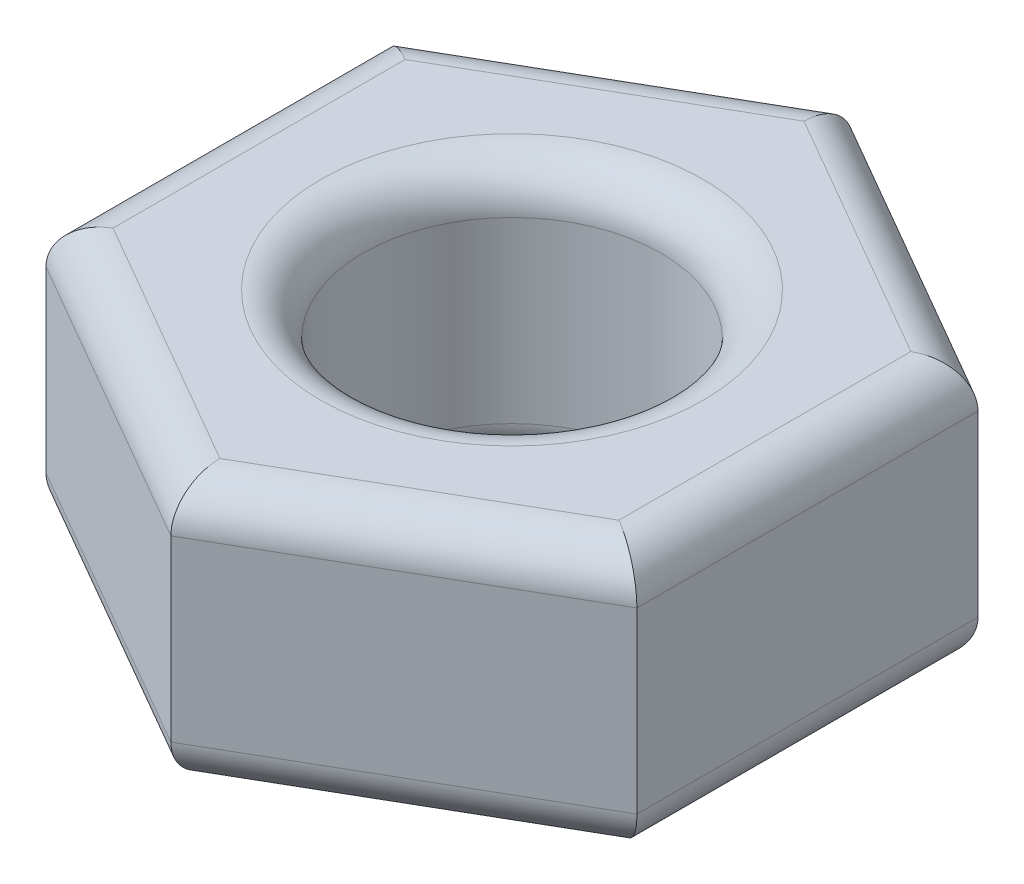
from build123d import *

# Parameters (mm, degrees)
SKETCH1_R           = 1.75
BOSS_EXTRUDE2_DEPTH = 3.1
FILLET1_R           = 0.5


with BuildPart() as part:
    # Sketch1 → Boss-Extrude2 (new body)
    with BuildSketch(Plane(origin=(0, 0, 0), x_dir=(1, 0, 0), z_dir=(0, 1, 0))):
        Polygon((0, -4.012584371), (3.475, -2.006292185), (3.475, 2.006292185), (0, 4.012584371), (-3.475, 2.006292185), (-3.475, -2.006292185), align=None)
        with Locations(Location((0, 0, 0), (0, 0, 90))):
            Circle(SKETCH1_R, mode=Mode.SUBTRACT)
    extrude(amount=BOSS_EXTRUDE2_DEPTH)

    # Fillet1
    fillet1_edges = [part.edges().sort_by_distance(p)[0] for p in [
        (3.475, 3.1, 0),
        (1.7375, 3.1, -3.009438278),
        (-1.7375, 3.1, -3.009438278),
        (0, 0, 1.75),
        (0, 3.1, 1.75),
        (-3.475, 3.1, 0),
        (-1.7375, 3.1, 3.009438278),
        (-3.475, 0, 0),
        (-1.7375, 0, -3.009438278),
        (1.7375, 0, -3.009438278),
        (1.7375, 3.1, 3.009438278),
        (3.475, 0, 0),
        (1.7375, 0, 3.009438278),
        (-1.7375, 0, 3.009438278),
    ]]
    fillet(fillet1_edges, radius=FILLET1_R)


solid = part.part
